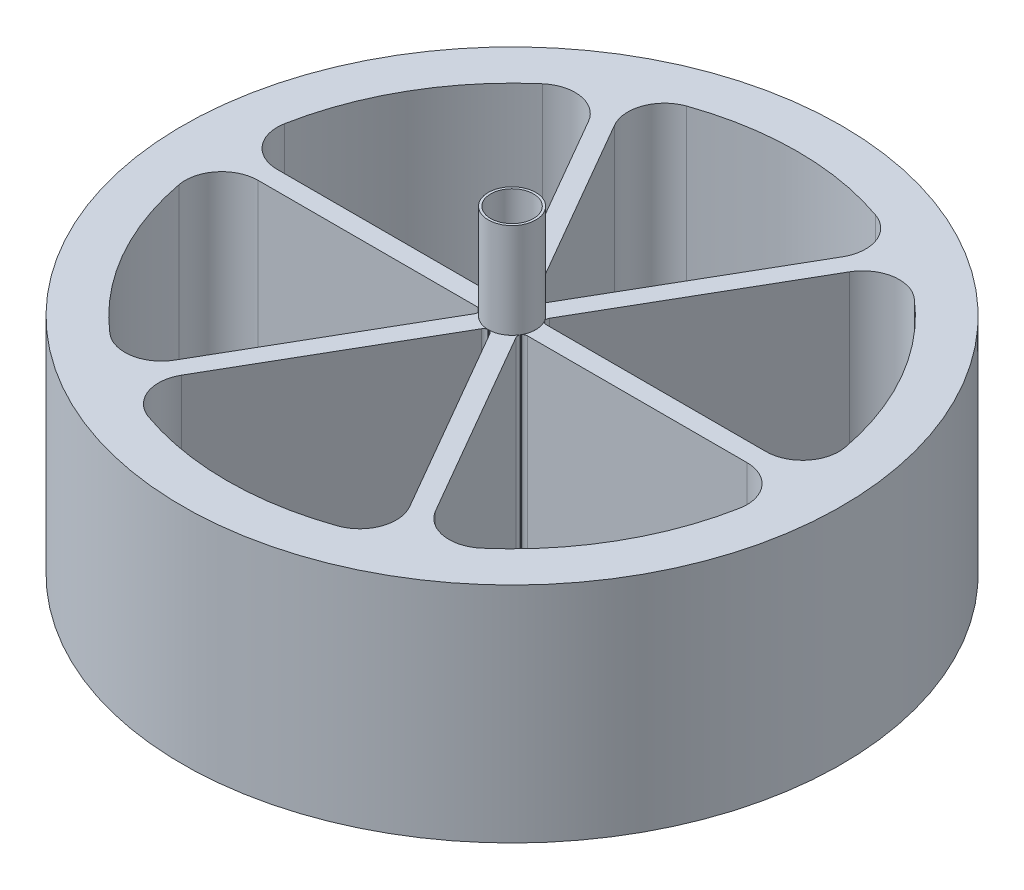
from build123d import *

# Parameters (mm, degrees)
SKETCH1_R             = 2.5
SKETCH1_R_2           = 1.5
BOSS_EXTRUDE1_DEPTH   = 10
BOSS_EXTRUDE3_DEPTH   = 23.5
BOSS_EXTRUDE3_2_DEPTH = 23.5
BOSS_EXTRUDE3_3_DEPTH = 23.5
BOSS_EXTRUDE3_4_DEPTH = 23.5
BOSS_EXTRUDE3_5_DEPTH = 23.5
BOSS_EXTRUDE3_6_DEPTH = 23.5
SKETCH5_R             = 34.666608733
SKETCH5_R_2           = 30
BOSS_EXTRUDE4_DEPTH   = 23.5
BOSS_EXTRUDE5_START   = -28
SKETCH6_R             = 1.5
BOSS_EXTRUDE5_DEPTH   = 28
SKETCH7_R             = 2.25
CUT_EXTRUDE1_DEPTH    = 28


with BuildPart() as part:
    # Sketch1 → Boss-Extrude1 (new body)
    with BuildSketch(Plane(origin=(0, 0, 0), x_dir=(1, 0, 0), z_dir=(0, 1, 0))):
        with Locations(Location((0, 0, 0), (0, 0, 270))):
            Circle(SKETCH1_R)
        with Locations(Location((0, 0, 0), (0, 0, 270))):
            Circle(SKETCH1_R_2, mode=Mode.SUBTRACT)
    extrude(amount=BOSS_EXTRUDE1_DEPTH)

    # Sketch6 → Boss-Extrude5 (add)
    with BuildSketch(Plane(origin=(0, 10, 0), x_dir=(1, 0, 0), z_dir=(0, 1, 0)).offset(BOSS_EXTRUDE5_START)):
        with Locations(Location((0, 0, 0), (0, 0, 270))):
            Circle(SKETCH6_R)
    extrude(amount=BOSS_EXTRUDE5_DEPTH)

    # Sketch7 → Cut-Extrude1 (cut)
    with BuildSketch(Plane(origin=(0, 10, 0), x_dir=(1, 0, 0), z_dir=(0, 1, 0))):
        with Locations(Location((0, 0, 0), (0, 0, 270))):
            Circle(SKETCH7_R)
    extrude(amount=-CUT_EXTRUDE1_DEPTH, mode=Mode.SUBTRACT)


with BuildPart() as body_2:
    # Sketch2 → Boss-Extrude3 (new body)
    with BuildSketch(Plane(origin=(0, 0, 0), x_dir=(-1, 0, 0), z_dir=(0, -1, 0))):
        with BuildLine():
            Line((2.61395079, 1), (25.707973339, 1))
            ThreePointArc((25.707973339, 1), (28.664062792, 2.388870469), (29.481986287, 5.550899437))
            ThreePointArc((29.481986287, 5.550899437), (30, 0), (29.481986287, -5.550899437))
            ThreePointArc((29.481986287, -5.550899437), (28.664062792, -2.388870469), (25.707973339, -1))
            Line((25.707973339, -1), (2.61395079, -1))
            ThreePointArc((2.61395079, -1), (2.399550586, -1.045528996), (2.222154945, -1.174257873))
            Line((2.222154945, -1.174257873), (2.178514499, -1.226407182))
            ThreePointArc((2.178514499, -1.226407182), (2.499969191, -0.012411485), (2.190584188, 1.204716114))
            Line((2.190584188, 1.204716114), (2.222154945, 1.174257873))
            ThreePointArc((2.222154945, 1.174257873), (2.399550586, 1.045528996), (2.61395079, 1))
        make_face()
    extrude(amount=BOSS_EXTRUDE3_DEPTH)



with BuildPart() as body_3:
    # Sketch2 → Boss-Extrude3 2 (new body)
    with BuildSketch(Plane(origin=(0, 0, 0), x_dir=(-1, 0, 0), z_dir=(0, -1, 0))):
        with BuildLine():
            Line((0.440949991, -2.763747789), (11.987961266, -22.763757991))
            ThreePointArc((11.987961266, -22.763757991), (12.263208883, -26.018241788), (9.933773217, -28.307598797))
            ThreePointArc((9.933773217, -28.307598797), (15, -25.980762114), (19.54821307, -22.75669936))
            ThreePointArc((19.54821307, -22.75669936), (16.400853909, -23.629371319), (13.720012073, -21.763757991))
            Line((13.720012073, -21.763757991), (2.173000799, -1.763747789))
            ThreePointArc((2.173000799, -1.763747789), (2.105229964, -1.555307267), (2.128014621, -1.337313697))
            Line((2.128014621, -1.337313697), (2.138606853, -1.294743499))
            ThreePointArc((2.138606853, -1.294743499), (1.239235934, -2.17124257), (0.027157474, -2.49985249))
            Line((0.027157474, -2.49985249), (0.094140324, -2.511571571))
            ThreePointArc((0.094140324, -2.511571571), (0.294320622, -2.600836263), (0.440949991, -2.763747789))
        make_face()
    extrude(amount=BOSS_EXTRUDE3_2_DEPTH)


with BuildPart() as body_4:
    # Sketch2 → Boss-Extrude3 3 (new body)
    with BuildSketch(Plane(origin=(0, 0, 0), x_dir=(-1, 0, 0), z_dir=(0, -1, 0))):
        with BuildLine():
            Line((-2.173000799, -1.763747789), (-13.720012073, -21.763757991))
            ThreePointArc((-13.720012073, -21.763757991), (-16.400853909, -23.629371319), (-19.54821307, -22.75669936))
            ThreePointArc((-19.54821307, -22.75669936), (-15, -25.980762114), (-9.933773217, -28.307598797))
            ThreePointArc((-9.933773217, -28.307598797), (-12.263208883, -26.018241788), (-11.987961266, -22.763757991))
            Line((-11.987961266, -22.763757991), (-0.440949991, -2.763747789))
            ThreePointArc((-0.440949991, -2.763747789), (-0.294320622, -2.600836263), (-0.094140324, -2.511571571))
            Line((-0.094140324, -2.511571571), (-0.051977335, -2.499459613))
            ThreePointArc((-0.051977335, -2.499459613), (-1.260733257, -2.158831086), (-2.151357025, -1.273445308))
            Line((-2.151357025, -1.273445308), (-2.128014621, -1.337313697))
            ThreePointArc((-2.128014621, -1.337313697), (-2.105229964, -1.555307267), (-2.173000799, -1.763747789))
        make_face()
    extrude(amount=BOSS_EXTRUDE3_3_DEPTH)


with BuildPart() as body_5:
    # Sketch2 → Boss-Extrude3 4 (new body)
    with BuildSketch(Plane(origin=(0, 0, 0), x_dir=(-1, 0, 0), z_dir=(0, -1, 0))):
        with BuildLine():
            Line((-2.61395079, 1), (-25.707973339, 1))
            ThreePointArc((-25.707973339, 1), (-28.664062792, 2.388870469), (-29.481986287, 5.550899437))
            ThreePointArc((-29.481986287, 5.550899437), (-30, 0), (-29.481986287, -5.550899437))
            ThreePointArc((-29.481986287, -5.550899437), (-28.664062792, -2.388870469), (-25.707973339, -1))
            Line((-25.707973339, -1), (-2.61395079, -1))
            ThreePointArc((-2.61395079, -1), (-2.399550586, -1.045528996), (-2.222154945, -1.174257873))
            Line((-2.222154945, -1.174257873), (-2.190584188, -1.204716114))
            ThreePointArc((-2.190584188, -1.204716114), (-2.499969191, 0.012411485), (-2.178514499, 1.226407182))
            Line((-2.178514499, 1.226407182), (-2.222154945, 1.174257873))
            ThreePointArc((-2.222154945, 1.174257873), (-2.399550586, 1.045528996), (-2.61395079, 1))
        make_face()
    extrude(amount=BOSS_EXTRUDE3_4_DEPTH)


with BuildPart() as body_6:
    # Sketch2 → Boss-Extrude3 5 (new body)
    with BuildSketch(Plane(origin=(0, 0, 0), x_dir=(-1, 0, 0), z_dir=(0, -1, 0))):
        with BuildLine():
            Line((-0.440949991, 2.763747789), (-11.987961266, 22.763757991))
            ThreePointArc((-11.987961266, 22.763757991), (-12.263208883, 26.018241788), (-9.933773217, 28.307598797))
            ThreePointArc((-9.933773217, 28.307598797), (-15, 25.980762114), (-19.54821307, 22.75669936))
            ThreePointArc((-19.54821307, 22.75669936), (-16.400853909, 23.629371319), (-13.720012073, 21.763757991))
            Line((-13.720012073, 21.763757991), (-2.173000799, 1.763747789))
            ThreePointArc((-2.173000799, 1.763747789), (-2.105229964, 1.555307267), (-2.128014621, 1.337313697))
            Line((-2.128014621, 1.337313697), (-2.138606853, 1.294743499))
            ThreePointArc((-2.138606853, 1.294743499), (-1.239235934, 2.17124257), (-0.027157474, 2.49985249))
            Line((-0.027157474, 2.49985249), (-0.094140324, 2.511571571))
            ThreePointArc((-0.094140324, 2.511571571), (-0.294320622, 2.600836263), (-0.440949991, 2.763747789))
        make_face()
    extrude(amount=BOSS_EXTRUDE3_5_DEPTH)


with BuildPart() as body_7:
    # Sketch2 → Boss-Extrude3 6 (new body)
    with BuildSketch(Plane(origin=(0, 0, 0), x_dir=(-1, 0, 0), z_dir=(0, -1, 0))):
        with BuildLine():
            Line((2.173000799, 1.763747789), (13.720012073, 21.763757991))
            ThreePointArc((13.720012073, 21.763757991), (16.400853909, 23.629371319), (19.54821307, 22.75669936))
            ThreePointArc((19.54821307, 22.75669936), (15, 25.980762114), (9.933773217, 28.307598797))
            ThreePointArc((9.933773217, 28.307598797), (12.263208883, 26.018241788), (11.987961266, 22.763757991))
            Line((11.987961266, 22.763757991), (0.440949991, 2.763747789))
            ThreePointArc((0.440949991, 2.763747789), (0.294320622, 2.600836263), (0.094140324, 2.511571571))
            Line((0.094140324, 2.511571571), (0.051977335, 2.499459613))
            ThreePointArc((0.051977335, 2.499459613), (1.260733257, 2.158831086), (2.151357025, 1.273445308))
            Line((2.151357025, 1.273445308), (2.128014621, 1.337313697))
            ThreePointArc((2.128014621, 1.337313697), (2.105229964, 1.555307267), (2.173000799, 1.763747789))
        make_face()
    extrude(amount=BOSS_EXTRUDE3_6_DEPTH)


with BuildPart() as body_2_1:
    add(body_2.part)

    add(body_3.part)  # Boss-Extrude4 merges body 3

    add(body_4.part)  # Boss-Extrude4 merges body 4

    add(body_5.part)  # Boss-Extrude4 merges body 5

    add(body_6.part)  # Boss-Extrude4 merges body 6

    add(body_7.part)  # Boss-Extrude4 merges body 7
    # Sketch5 → Boss-Extrude4 (add)
    with BuildSketch(Plane(origin=(0, -23.5, 0), x_dir=(-1, 0, 0), z_dir=(0, -1, 0))):
        with Locations(Location((0, 0, 0), (0, 0, 90))):
            Circle(SKETCH5_R)
        Circle(SKETCH5_R_2, mode=Mode.SUBTRACT)
    extrude(amount=-BOSS_EXTRUDE4_DEPTH)


solid = Compound([part.part, body_2_1.part])
